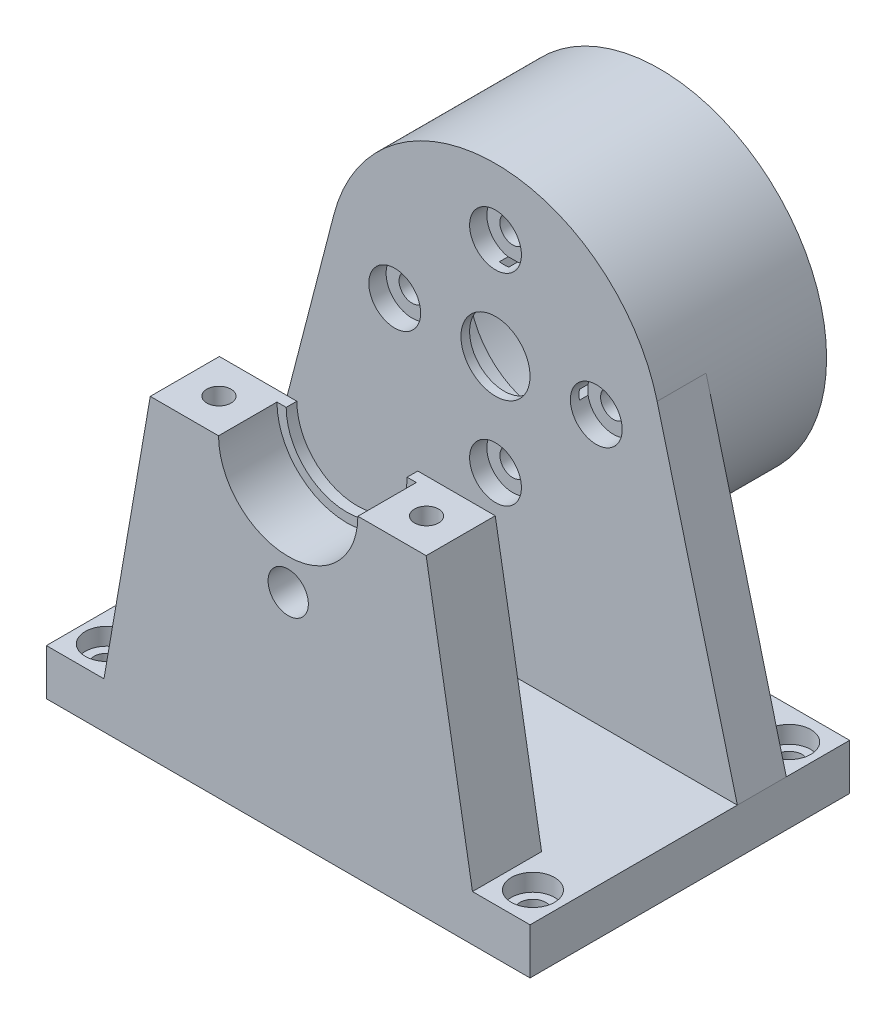
from build123d import *

# Parameters (mm, degrees)
ESTRUSIONE_ESTRUSIONE1_DEPTH  = 12
ESTRUSIONE_ESTRUSIONE2_START  = -1.85
ESTRUSIONE_ESTRUSIONE2_DEPTH  = 1.85
ESTRUSIONE_ESTRUSIONE3_DEPTH  = 1.85
ESTRUSIONE_ESTRUSIONE4_DEPTH  = 23.5
ESTRUSIONE_ESTRUSIONE5_START  = 1.85
ESTRUSIONE_ESTRUSIONE5_DEPTH  = 1.85
ESTRUSIONE_ESTRUSIONE6_START  = 8.3
ESTRUSIONE_ESTRUSIONE6_DEPTH  = 8.3
ESTRUSIONE_ESTRUSIONE7_START  = 1.85
ESTRUSIONE_ESTRUSIONE7_DEPTH  = 1.85
ESTRUSIONE_ESTRUSIONE8_DEPTH  = 23.5
ESTRUSIONE_ESTRUSIONE9_START  = 1.85
ESTRUSIONE_ESTRUSIONE9_DEPTH  = 1.85
ESTRUSIONE_ESTRUSIONE10_START = 8.3
ESTRUSIONE_ESTRUSIONE10_DEPTH = 8.3
ESTRUSIONE_ESTRUSIONE11_START = 1.85
ESTRUSIONE_ESTRUSIONE11_DEPTH = 1.85
SCHIZZO12_R                   = 2.25
TAGLIO_ESTRUSIONE1_DEPTH      = 95.695564838
SCHIZZO13_R                   = 2.1
TAGLIO_ESTRUSIONE2_DEPTH      = 6
SCHIZZO15_R                   = 2.1
TAGLIO_ESTRUSIONE4_DEPTH      = 5
SCHIZZO16_R                   = 2.25
TAGLIO_ESTRUSIONE5_DEPTH      = 99.869863963
ESTRUSIONE_ESTRUSIONE12_DEPTH = 24
SCHIZZO18_R                   = 6
SCHIZZO18_R_2                 = 2.25
ESTRUSIONE_ESTRUSIONE13_DEPTH = 8.5
SCHIZZO19_R                   = 13.1
TAGLIO_ESTRUSIONE6_DEPTH      = 7
SCHIZZO20_R                   = 29
SCHIZZO20_R_2                 = 26.25
ESTRUSIONE_ESTRUSIONE14_DEPTH = 20
TAGLIO_ESTRUSIONE8_REACH      = 96.311
SCHIZZO21_R                   = 3.5
SCHIZZO21_R_2                 = 2.25
SCHIZZO22_W                   = 84
SCHIZZO22_H                   = 8
ESTRUSIONE_ESTRUSIONE15_DEPTH = 11
SCHIZZO23_R                   = 2.25
TAGLIO_ESTRUSIONE9_DEPTH      = 102.096488564
SCHIZZO24_R                   = 3.75
TAGLIO_ESTRUSIONE10_DEPTH     = 3
TAGLIO_ESTRUSIONE11_DEPTH     = 94.055212106
SCHIZZO26_R                   = 4.5
TAGLIO_ESTRUSIONE12_DEPTH     = 3


with BuildPart() as part:
    # Schizzo1 → Estrusione-Estrusione1 (new body)
    with BuildSketch(Plane.XY):
        with BuildLine():
            Line((-12.1, 0), (-21, 0))
            Line((-21, 0), (-21, -17.1))
            Line((-21, -17.1), (21, -17.1))
            Line((21, -17.1), (21, 0))
            Line((21, 0), (12.1, 0))
            ThreePointArc((12.1, 0), (0, -12.1), (-12.1, 0))
        make_face()
        Polygon((-42, -46.5), (-42, -54.5), (42, -54.5), (42, -46.5), (32, -46.5), (23.95754717, 0), (21, 0), (21, -17.1), (-21, -17.1), (-21, 0), (-23.95754717, 0), (-32, -46.5), align=None)
    extrude(amount=ESTRUSIONE_ESTRUSIONE1_DEPTH)

    # Schizzo2 → Estrusione-Estrusione2 (add)
    with BuildSketch(Plane.XY.offset(12).offset(ESTRUSIONE_ESTRUSIONE2_START)):
        with BuildLine():
            Line((12.1, 0), (10.5, 0))
            ThreePointArc((10.5, 0), (0, -10.5), (-10.5, 0))
            Line((-10.5, 0), (-12.1, 0))
            ThreePointArc((-12.1, 0), (0, -12.1), (12.1, 0))
        make_face()
    extrude(amount=ESTRUSIONE_ESTRUSIONE2_DEPTH)

    # Schizzo3 → Estrusione-Estrusione3 (add)
    with BuildSketch(Plane(origin=(0, 0, 0), x_dir=(-1, 0, 0), z_dir=(0, 0, -1))):
        with BuildLine():
            Line((12.1, 0), (10.5, 0))
            ThreePointArc((10.5, 0), (0, -10.5), (-10.5, 0))
            Line((-10.5, 0), (-12.1, 0))
            ThreePointArc((-12.1, 0), (0, -12.1), (12.1, 0))
        make_face()
    extrude(amount=-ESTRUSIONE_ESTRUSIONE3_DEPTH)

    # Schizzo4 → Estrusione-Estrusione4 (add)
    with BuildSketch(Plane(origin=(0, 0, 0), x_dir=(-1, 0, 0), z_dir=(0, 0, -1))):
        with BuildLine():
            Line((-27.454507827, -46.5), (-32, -46.5))
            Line((-32, -46.5), (-42, -46.5))
            Line((-42, -46.5), (-42, -54.5))
            Line((-42, -54.5), (42, -54.5))
            Line((42, -54.5), (42, -46.5))
            Line((42, -46.5), (32, -46.5))
            Line((32, -46.5), (27.454507827, -46.5))
            ThreePointArc((27.454507827, -46.5), (0, -54), (-27.454507827, -46.5))
        make_face()
    extrude(amount=ESTRUSIONE_ESTRUSIONE4_DEPTH)

    # Schizzo5 → Estrusione-Estrusione5 (add)
    with BuildSketch(Plane(origin=(0, 0, -23.5), x_dir=(-1, 0, 0), z_dir=(0, 0, -1)).offset(ESTRUSIONE_ESTRUSIONE5_START)):
        with BuildLine():
            Line((23.95754717, 0), (10.5, 0))
            ThreePointArc((10.5, 0), (0, -10.5), (-10.5, 0))
            Line((-10.5, 0), (-23.95754717, 0))
            Line((-23.95754717, 0), (-32, -46.5))
            Line((-32, -46.5), (-42, -46.5))
            Line((-42, -46.5), (-42, -54.5))
            Line((-42, -54.5), (42, -54.5))
            Line((42, -54.5), (42, -46.5))
            Line((42, -46.5), (32, -46.5))
            Line((32, -46.5), (23.95754717, 0))
        make_face()
    extrude(amount=-ESTRUSIONE_ESTRUSIONE5_DEPTH)

    # Schizzo6 → Estrusione-Estrusione6 (add)
    with BuildSketch(Plane(origin=(0, 0, -25.35), x_dir=(-1, 0, 0), z_dir=(0, 0, -1)).offset(ESTRUSIONE_ESTRUSIONE6_START)):
        with BuildLine():
            ThreePointArc((12.1, 0), (0, -12.1), (-12.1, 0))
            Line((-12.1, 0), (-23.95754717, 0))
            Line((-23.95754717, 0), (-32, -46.5))
            Line((-32, -46.5), (-42, -46.5))
            Line((-42, -46.5), (-42, -54.5))
            Line((-42, -54.5), (42, -54.5))
            Line((42, -54.5), (42, -46.5))
            Line((42, -46.5), (32, -46.5))
            Line((32, -46.5), (23.95754717, 0))
            Line((23.95754717, 0), (12.1, 0))
        make_face()
    extrude(amount=-ESTRUSIONE_ESTRUSIONE6_DEPTH)

    # Schizzo7 → Estrusione-Estrusione7 (add)
    with BuildSketch(Plane(origin=(0, 0, -33.65), x_dir=(-1, 0, 0), z_dir=(0, 0, -1)).offset(ESTRUSIONE_ESTRUSIONE7_START)):
        with BuildLine():
            Line((23.95754717, 0), (10.5, 0))
            ThreePointArc((10.5, 0), (0, -10.5), (-10.5, 0))
            Line((-10.5, 0), (-23.95754717, 0))
            Line((-23.95754717, 0), (-32, -46.5))
            Line((-32, -46.5), (-42, -46.5))
            Line((-42, -46.5), (-42, -54.5))
            Line((-42, -54.5), (42, -54.5))
            Line((42, -54.5), (42, -46.5))
            Line((42, -46.5), (32, -46.5))
            Line((32, -46.5), (23.95754717, 0))
        make_face()
    extrude(amount=-ESTRUSIONE_ESTRUSIONE7_DEPTH)

    # Schizzo8 → Estrusione-Estrusione8 (add)
    with BuildSketch(Plane(origin=(0, 0, -35.5), x_dir=(-1, 0, 0), z_dir=(0, 0, -1))):
        Polygon((-32, -46.5), (32, -46.5), (42, -46.5), (42, -54.5), (-42, -54.5), (-42, -46.5), align=None)
    extrude(amount=ESTRUSIONE_ESTRUSIONE8_DEPTH)

    # Schizzo9 → Estrusione-Estrusione9 (add)
    with BuildSketch(Plane(origin=(0, 0, -59), x_dir=(-1, 0, 0), z_dir=(0, 0, -1)).offset(ESTRUSIONE_ESTRUSIONE9_START)):
        with BuildLine():
            Line((23.95754717, 0), (10.5, 0))
            ThreePointArc((10.5, 0), (0, -10.5), (-10.5, 0))
            Line((-10.5, 0), (-23.95754717, 0))
            Line((-23.95754717, 0), (-32, -46.5))
            Line((-32, -46.5), (-42, -46.5))
            Line((-42, -46.5), (-42, -54.5))
            Line((-42, -54.5), (42, -54.5))
            Line((42, -54.5), (42, -46.5))
            Line((42, -46.5), (32, -46.5))
            Line((32, -46.5), (23.95754717, 0))
        make_face()
    extrude(amount=-ESTRUSIONE_ESTRUSIONE9_DEPTH)

    # Schizzo10 → Estrusione-Estrusione10 (add)
    with BuildSketch(Plane(origin=(0, 0, -60.85), x_dir=(-1, 0, 0), z_dir=(0, 0, -1)).offset(ESTRUSIONE_ESTRUSIONE10_START)):
        with BuildLine():
            ThreePointArc((12.1, 0), (0, -12.1), (-12.1, 0))
            Line((-12.1, 0), (-23.95754717, 0))
            Line((-23.95754717, 0), (-32, -46.5))
            Line((-32, -46.5), (-42, -46.5))
            Line((-42, -46.5), (-42, -54.5))
            Line((-42, -54.5), (42, -54.5))
            Line((42, -54.5), (42, -46.5))
            Line((42, -46.5), (32, -46.5))
            Line((32, -46.5), (23.95754717, 0))
            Line((23.95754717, 0), (12.1, 0))
        make_face()
    extrude(amount=-ESTRUSIONE_ESTRUSIONE10_DEPTH)

    # Schizzo11 → Estrusione-Estrusione11 (add)
    with BuildSketch(Plane(origin=(0, 0, -69.15), x_dir=(-1, 0, 0), z_dir=(0, 0, -1)).offset(ESTRUSIONE_ESTRUSIONE11_START)):
        with BuildLine():
            Line((23.95754717, 0), (10.5, 0))
            ThreePointArc((10.5, 0), (0, -10.5), (-10.5, 0))
            Line((-10.5, 0), (-23.95754717, 0))
            Line((-23.95754717, 0), (-32, -46.5))
            Line((-32, -46.5), (-42, -46.5))
            Line((-42, -46.5), (-42, -54.5))
            Line((-42, -54.5), (42, -54.5))
            Line((42, -54.5), (42, -46.5))
            Line((42, -46.5), (32, -46.5))
            Line((32, -46.5), (23.95754717, 0))
        make_face()
    extrude(amount=-ESTRUSIONE_ESTRUSIONE11_DEPTH)

    # Schizzo12 → Taglio-Estrusione1 (cut, through all)
    with BuildSketch(Plane(origin=(0, -46.5, 0), x_dir=(1, 0, 0), z_dir=(0, 1, 0))):
        with Locations(Location((37, -6.5, 0), (0, 0, 270))):
            Circle(SCHIZZO12_R)
        with Locations(Location((37, 28.5, 0), (0, 0, 270))):
            Circle(SCHIZZO12_R)
        with Locations(Location((37, 65.5, 0), (0, 0, 270))):
            Circle(SCHIZZO12_R)
        with Locations(Location((-37, -6.5, 0), (0, 0, 270))):
            Circle(SCHIZZO12_R)
        with Locations(Location((-37, 28.5, 0), (0, 0, 270))):
            Circle(SCHIZZO12_R)
        with Locations(Location((-37, 65.5, 0), (0, 0, 270))):
            Circle(SCHIZZO12_R)
    extrude(amount=-TAGLIO_ESTRUSIONE1_DEPTH, mode=Mode.SUBTRACT)

    # Schizzo13 → Taglio-Estrusione2 (cut)
    with BuildSketch(Plane(origin=(0, 0, 0), x_dir=(1, 0, 0), z_dir=(0, 1, 0))):
        with Locations(Location((18.028773585, -6, 0), (0, 0, 180))):
            Circle(SCHIZZO13_R)
        with Locations(Location((-18.028773585, -6, 0), (0, 0, 180))):
            Circle(SCHIZZO13_R)
        with Locations(Location((18.028773585, 29.5, 0), (0, 0, 180))):
            Circle(SCHIZZO13_R)
        with Locations(Location((-18.028773585, 29.5, 0), (0, 0, 180))):
            Circle(SCHIZZO13_R)
        with Locations(Location((18.028773585, 65, 0), (0, 0, 180))):
            Circle(SCHIZZO13_R)
        with Locations(Location((-18.028773585, 65, 0), (0, 0, 180))):
            Circle(SCHIZZO13_R)
    extrude(amount=-TAGLIO_ESTRUSIONE2_DEPTH, mode=Mode.SUBTRACT)

    # Schizzo15 → Taglio-Estrusione4 (cut)
    with BuildSketch(Plane(origin=(0, -6, 0), x_dir=(1, 0, 0), z_dir=(0, 1, 0))):
        with Locations(Location((-18.028773585, 65, 0), (0, 0, 180))):
            Circle(SCHIZZO15_R)
        with Locations(Location((18.028773585, 65, 0), (0, 0, 180))):
            Circle(SCHIZZO15_R)
        with Locations(Location((18.028773585, 29.5, 0), (0, 0, 180))):
            Circle(SCHIZZO15_R)
        with Locations(Location((-18.028773585, 29.5, 0), (0, 0, 180))):
            Circle(SCHIZZO15_R)
        with Locations(Location((-18.028773585, -6, 0), (0, 0, 180))):
            Circle(SCHIZZO15_R)
        with Locations(Location((18.028773585, -6, 0), (0, 0, 180))):
            Circle(SCHIZZO15_R)
    extrude(amount=-TAGLIO_ESTRUSIONE4_DEPTH, mode=Mode.SUBTRACT)

    # Schizzo16 → Taglio-Estrusione5 (cut, through all)
    with BuildSketch(Plane.XZ.offset(54.5)):
        Polygon((-10.5, 0), (-23.95754717, 0), (-42, 0), (-42, -71), (42, -71), (42, 0), (23.95754717, 0), (10.5, 0), align=None)
        with Locations((-37, -65.5)):
            Circle(SCHIZZO16_R, mode=Mode.SUBTRACT)
        with Locations((37, -65.5)):
            Circle(SCHIZZO16_R, mode=Mode.SUBTRACT)
        with Locations((-37, -28.5)):
            Circle(SCHIZZO16_R, mode=Mode.SUBTRACT)
        with Locations((37, -28.5)):
            Circle(SCHIZZO16_R, mode=Mode.SUBTRACT)
    extrude(amount=-TAGLIO_ESTRUSIONE5_DEPTH, mode=Mode.SUBTRACT)

    # Schizzo17 → Estrusione-Estrusione12 (add)
    with BuildSketch(Plane(origin=(0, 0, 0), x_dir=(-1, 0, 0), z_dir=(0, 0, -1))):
        Polygon((-32, -46.5), (32, -46.5), (42, -46.5), (42, -54.5), (-42, -54.5), (-42, -46.5), align=None)
    extrude(amount=ESTRUSIONE_ESTRUSIONE12_DEPTH)

    # Schizzo18 → Estrusione-Estrusione13 (add)
    with BuildSketch(Plane(origin=(0, 0, -24), x_dir=(-1, 0, 0), z_dir=(0, 0, -1))):
        with BuildLine():
            Line((-42, -46.5), (-28.073726485, 7.270892739))
            ThreePointArc((-28.073726485, 7.270892739), (0, 29), (28.073726485, 7.270892739))
            Line((28.073726485, 7.270892739), (42, -46.5))
            Line((42, -46.5), (42, -54.5))
            Line((42, -54.5), (-42, -54.5))
            Line((-42, -54.5), (-42, -46.5))
        make_face()
        Circle(SCHIZZO18_R, mode=Mode.SUBTRACT)
        with Locations((0, 17.5)):
            Circle(SCHIZZO18_R_2, mode=Mode.SUBTRACT)
        with Locations((17.5, 0)):
            Circle(SCHIZZO18_R_2, mode=Mode.SUBTRACT)
        with Locations((0, -17.5)):
            Circle(SCHIZZO18_R_2, mode=Mode.SUBTRACT)
        with Locations((-17.5, 0)):
            Circle(SCHIZZO18_R_2, mode=Mode.SUBTRACT)
    extrude(amount=ESTRUSIONE_ESTRUSIONE13_DEPTH)

    # Schizzo19 → Taglio-Estrusione6 (cut)
    with BuildSketch(Plane(origin=(0, 0, -32.5), x_dir=(-1, 0, 0), z_dir=(0, 0, -1))):
        Circle(SCHIZZO19_R)
    extrude(amount=-TAGLIO_ESTRUSIONE6_DEPTH, mode=Mode.SUBTRACT)

    # Schizzo20 → Estrusione-Estrusione14 (add)
    with BuildSketch(Plane(origin=(0, 0, -32.5), x_dir=(-1, 0, 0), z_dir=(0, 0, -1))):
        with Locations(Location((0, 0, 0), (0, 0, 165.479851844))):
            Circle(SCHIZZO20_R)
        Circle(SCHIZZO20_R_2, mode=Mode.SUBTRACT)
    extrude(amount=ESTRUSIONE_ESTRUSIONE14_DEPTH)

    # Schizzo21 → Taglio-Estrusione8 (cut, up to next)
    with BuildSketch(Plane.XY.offset(12), mode=Mode.PRIVATE) as taglio_estrusione8_sk1:
        with Locations((0, -17.5)):
            Circle(SCHIZZO21_R)
        with Locations(Location((0, -17.5, 0), (0, 0, 180))):
            Circle(SCHIZZO21_R_2, mode=Mode.SUBTRACT)
    taglio_estrusione8_tool1 = extrude(taglio_estrusione8_sk1.sketch, amount=-TAGLIO_ESTRUSIONE8_REACH, mode=Mode.PRIVATE) & part.part
    # Schizzo21 → Taglio-Estrusione8 (cut, up to next)
    with BuildSketch(Plane.XY.offset(12), mode=Mode.PRIVATE) as taglio_estrusione8_sk2:
        with Locations(Location((0, -17.5, 0), (0, 0, 180))):
            Circle(SCHIZZO21_R_2)
    taglio_estrusione8_tool2 = extrude(taglio_estrusione8_sk2.sketch, amount=-TAGLIO_ESTRUSIONE8_REACH, mode=Mode.PRIVATE) & part.part
    add(taglio_estrusione8_tool1.solids().sort_by_distance((-3.401005, -17.5, 12))[0], mode=Mode.SUBTRACT)
    add(taglio_estrusione8_tool2.solids().sort_by_distance((0, -17.5, 12))[0], mode=Mode.SUBTRACT)

    # Schizzo22 → Estrusione-Estrusione15 (add)
    with BuildSketch(Plane(origin=(0, 0, -32.5), x_dir=(-1, 0, 0), z_dir=(0, 0, -1))):
        with Locations((0, -50.5)):
            Rectangle(SCHIZZO22_W, SCHIZZO22_H)
    extrude(amount=ESTRUSIONE_ESTRUSIONE15_DEPTH)

    # Schizzo23 → Taglio-Estrusione9 (cut, through all)
    with BuildSketch(Plane(origin=(0, -46.5, 0), x_dir=(1, 0, 0), z_dir=(0, 1, 0))):
        with Locations(Location((37, 38, 0), (0, 0, 270))):
            Circle(SCHIZZO23_R)
        with Locations(Location((-37, 38, 0), (0, 0, 270))):
            Circle(SCHIZZO23_R)
    extrude(amount=-TAGLIO_ESTRUSIONE9_DEPTH, mode=Mode.SUBTRACT)

    # Schizzo24 → Taglio-Estrusione10 (cut)
    with BuildSketch(Plane(origin=(0, -46.5, 0), x_dir=(1, 0, 0), z_dir=(0, 1, 0))):
        with Locations(Location((37, -6.5, 0), (0, 0, 270))):
            Circle(SCHIZZO24_R)
        with Locations(Location((-37, -6.5, 0), (0, 0, 270))):
            Circle(SCHIZZO24_R)
        with Locations(Location((-37, 38, 0), (0, 0, 270))):
            Circle(SCHIZZO24_R)
        with Locations(Location((37, 38, 0), (0, 0, 270))):
            Circle(SCHIZZO24_R)
    extrude(amount=-TAGLIO_ESTRUSIONE10_DEPTH, mode=Mode.SUBTRACT)

    # Schizzo25 → Taglio-Estrusione11 (cut, through all)
    with BuildSketch(Plane(origin=(0, 0, 10.15), x_dir=(-1, 0, 0), z_dir=(0, 0, -1))):
        with BuildLine():
            Line((-10.5, 0), (-12.1, 0))
            ThreePointArc((-12.1, 0), (0, -12.1), (12.1, 0))
            Line((12.1, 0), (10.5, 0))
            ThreePointArc((10.5, 0), (0, -10.5), (-10.5, 0))
        make_face()
    extrude(amount=-TAGLIO_ESTRUSIONE11_DEPTH, mode=Mode.SUBTRACT)

    # Schizzo26 → Taglio-Estrusione12 (cut)
    with BuildSketch(Plane.XY.offset(-24)):
        with Locations((0, 17.5)):
            Circle(SCHIZZO26_R)
        with Locations((17.5, 0)):
            Circle(SCHIZZO26_R)
        with Locations((0, -17.5)):
            Circle(SCHIZZO26_R)
        with Locations((-17.5, 0)):
            Circle(SCHIZZO26_R)
    extrude(amount=-TAGLIO_ESTRUSIONE12_DEPTH, mode=Mode.SUBTRACT)


solid = part.part
